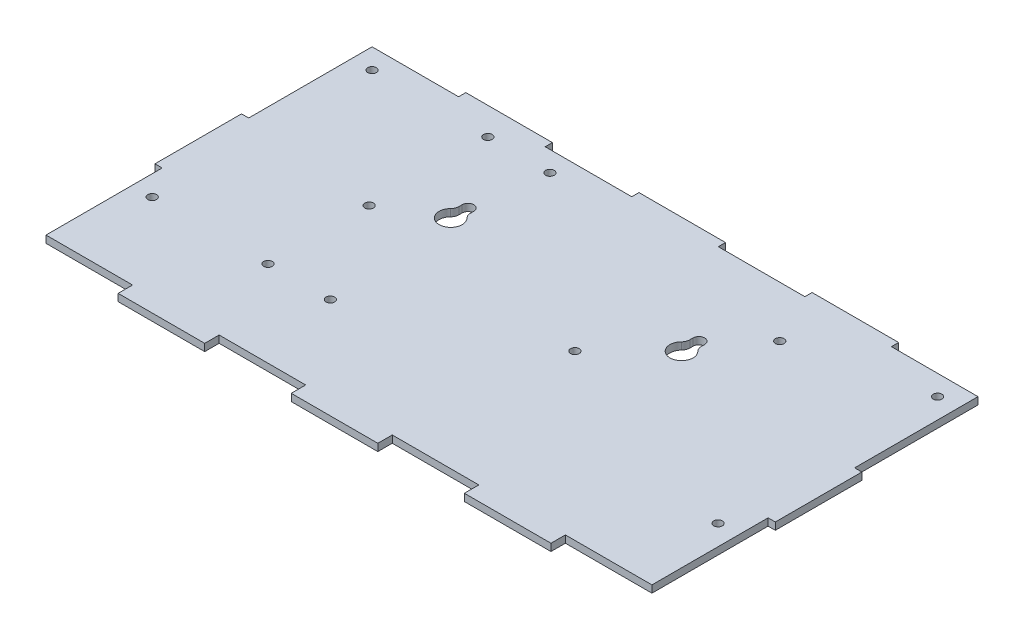
from build123d import *

# Parameters (mm, degrees)
BOSS_EXTRUDE2_DEPTH = 1.25
SKETCH5_R           = 1.5
CUT_EXTRUDE3_DEPTH  = 124.258113323


with BuildPart() as part:
    # Sketch2<4> → Boss-Extrude2 (new, symmetric)
    with BuildSketch(Plane(origin=(0, 0, 0), x_dir=(1, 0, 0), z_dir=(0, 1, 0))):
        Polygon((-105, -15), (-105, -55.25), (-75, -55.25), (-75, -60.25), (-45, -60.25), (-45, -55.25), (-15, -55.25), (-15, -60.25), (15, -60.25), (15, -55.25), (45, -55.25), (45, -60.25), (75, -60.25), (75, -55.25), (105, -55.25), (105, -15), (107.5, -15), (107.5, 15), (105, 15), (105, 57.75), (75, 57.75), (75, 60.25), (45, 60.25), (45, 57.75), (15, 57.75), (15, 60.25), (-15, 60.25), (-15, 57.75), (-45, 57.75), (-45, 60.25), (-75, 60.25), (-75, 57.75), (-105, 57.75), (-105, 15), (-107.5, 15), (-107.5, -15), align=None)
    extrude(amount=BOSS_EXTRUDE2_DEPTH, both=True)

    # Sketch5 → Cut-Extrude3 (cut, through all)
    with BuildSketch(Plane(origin=(0, 1.25, 0), x_dir=(1, 0, 0), z_dir=(0, 1, 0))):
        with Locations((98, 50.75)):
            Circle(SKETCH5_R)
        with Locations((-36.37, 50.75)):
            Circle(SKETCH5_R)
        with Locations((-36.37, -25.32)):
            Circle(SKETCH5_R)
        with Locations((98, -25.32)):
            Circle(SKETCH5_R)
        with Locations((53.99, 40.05)):
            Circle(SKETCH5_R)
        with Locations((21.48, 1.57)):
            Circle(SKETCH5_R)
        with Locations((-98, 50.75)):
            Circle(SKETCH5_R)
        with Locations((-57.87, 50.75)):
            Circle(SKETCH5_R)
        with Locations((-98, -25.45)):
            Circle(SKETCH5_R)
        with Locations((-57.87, -25.45)):
            Circle(SKETCH5_R)
        with Locations((-57.87, 9.6)):
            Circle(SKETCH5_R)
        with BuildLine():
            Line((-38, 26), (-38, 24.898979486))
            ThreePointArc((-38, 24.898979486), (-37.777460299, 23.765086067), (-37.142857143, 22.799416849))
            ThreePointArc((-37.142857143, 22.799416849), (-40, 16), (-42.857142857, 22.799416849))
            ThreePointArc((-42.857142857, 22.799416849), (-42.222539701, 23.765086067), (-42, 24.898979486))
            Line((-42, 24.898979486), (-42, 26))
            ThreePointArc((-42, 26), (-40, 28), (-38, 26))
        make_face()
        with BuildLine():
            Line((42, 26), (42, 24.898979486))
            ThreePointArc((42, 24.898979486), (42.222539701, 23.765086067), (42.857142857, 22.799416849))
            ThreePointArc((42.857142857, 22.799416849), (40, 16), (37.142857143, 22.799416849))
            ThreePointArc((37.142857143, 22.799416849), (37.777460299, 23.765086067), (38, 24.898979486))
            Line((38, 24.898979486), (38, 26))
            ThreePointArc((38, 26), (40, 28), (42, 26))
        make_face()
    extrude(amount=-CUT_EXTRUDE3_DEPTH, mode=Mode.SUBTRACT)


solid = part.part
